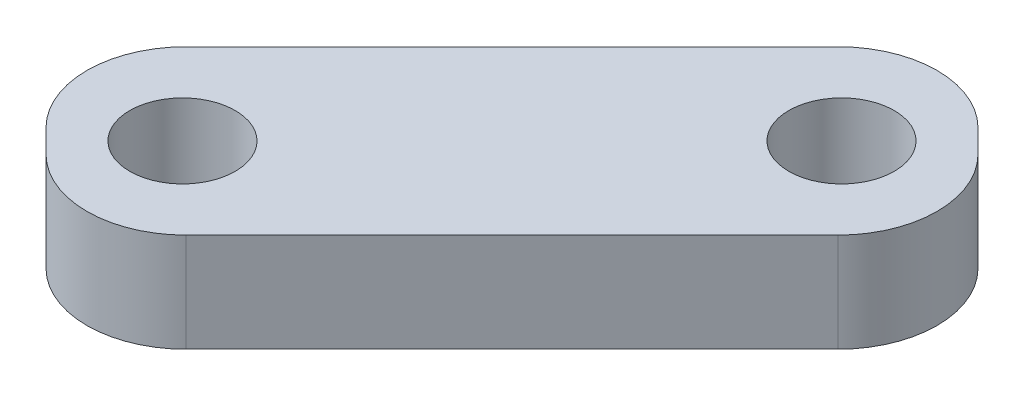
from build123d import *

# Parameters (mm, degrees)
CROQUIS1_R              = 1.6
SALIENTE_EXTRUIR1_DEPTH = 3
REDONDEO1_R             = 3


with BuildPart() as part:
    # Croquis1 → Saliente-Extruir1 (new body)
    with BuildSketch(Plane(origin=(0, 0, 0), x_dir=(1, 0, 0), z_dir=(0, 1, 0))):
        Polygon((-9.545941546, -4.596194078), (4.596194078, 9.545941546), (9.545941546, 4.596194078), (-4.596194078, -9.545941546), align=None)
        with Locations(Location((-5, -5, 0), (0, 0, 270))):
            Circle(CROQUIS1_R, mode=Mode.SUBTRACT)
        with Locations(Location((5, 5, 0), (0, 0, 270))):
            Circle(CROQUIS1_R, mode=Mode.SUBTRACT)
    extrude(amount=SALIENTE_EXTRUIR1_DEPTH)

    # Redondeo1
    redondeo1_edges = [part.edges().sort_by_distance(p)[0] for p in [
        (-9.545941546, 1.5, 4.596194078),
        (4.596194078, 1.5, -9.545941546),
        (9.545941546, 1.5, -4.596194078),
        (-4.596194078, 1.5, 9.545941546),
    ]]
    fillet(redondeo1_edges, radius=REDONDEO1_R)


solid = part.part
